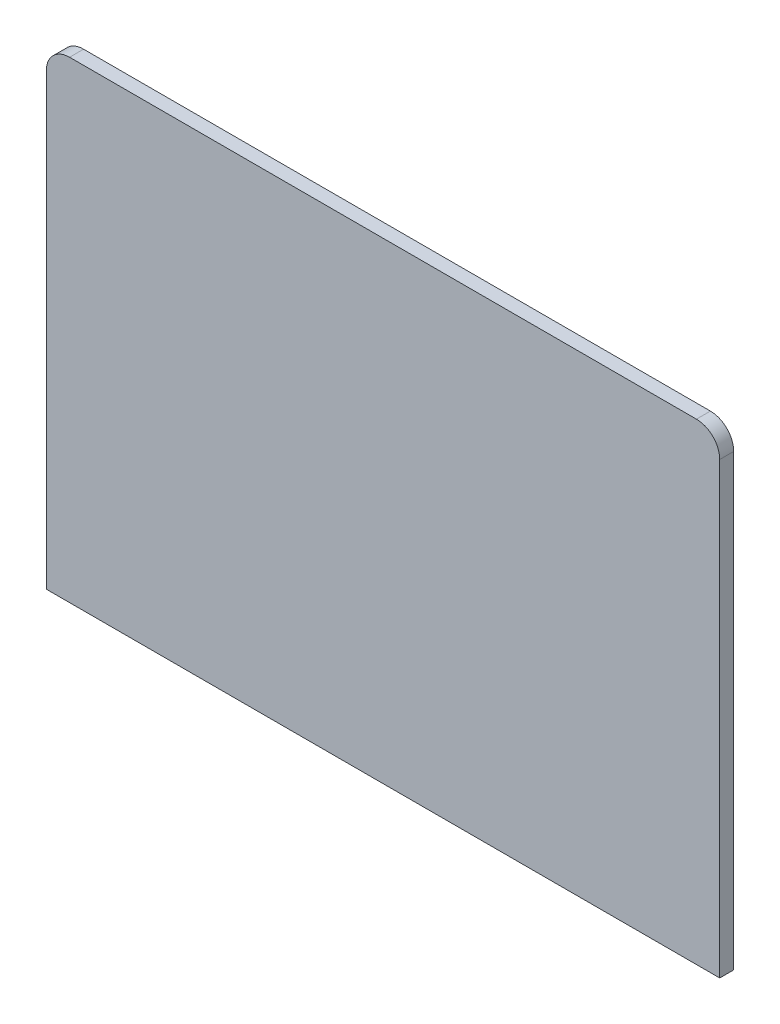
from build123d import *

# Parameters (mm, degrees)
SKETCH1_W           = 144.5
SKETCH1_H           = 101.35
BOSS_EXTRUDE1_DEPTH = 3
FILLET1_R           = 5


with BuildPart() as part:
    # Sketch1 → Boss-Extrude1 (new body)
    with BuildSketch(Plane.XY):
        with Locations((72.25, 50.675)):
            Rectangle(SKETCH1_W, SKETCH1_H)
    extrude(amount=BOSS_EXTRUDE1_DEPTH)

    # Fillet1
    fillet1_edges = [part.edges().sort_by_distance(p)[0] for p in [
        (0, 101.35, 1.5),
        (144.5, 101.35, 1.5),
    ]]
    fillet(fillet1_edges, radius=FILLET1_R)


solid = part.part
